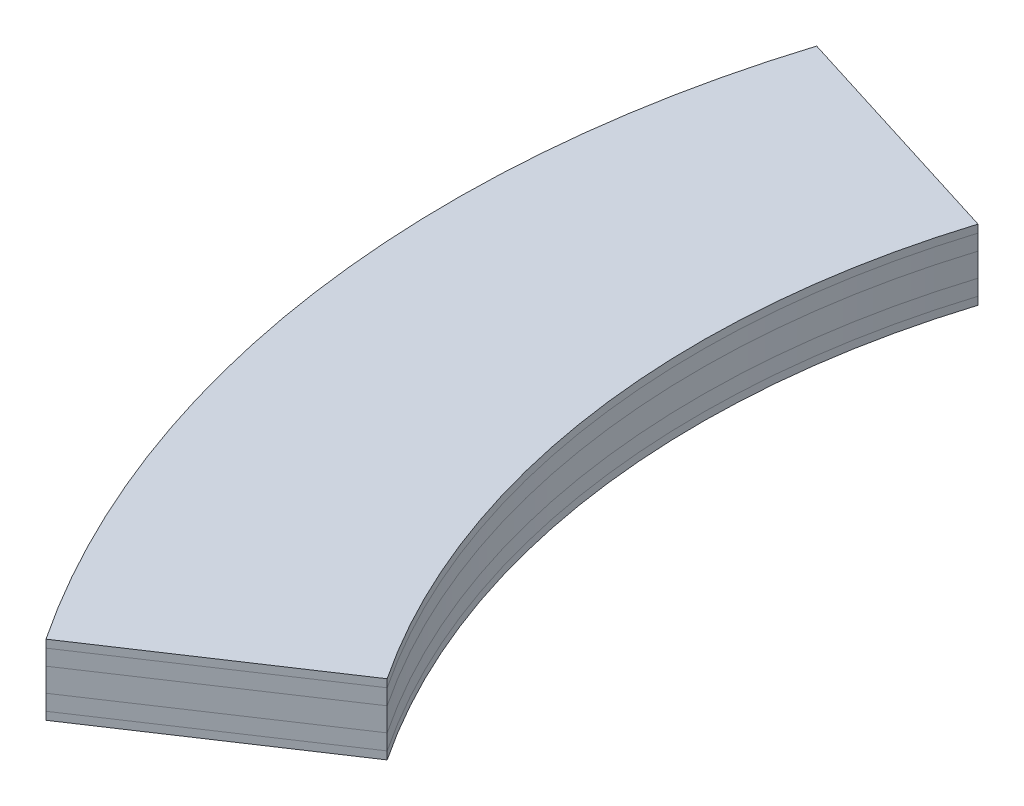
from build123d import *

# Parameters (mm, degrees)
SKETCH3_W                = 609.6
SKETCH3_H                = 1219.2
BOSS_EXTRUDE1_DEPTH      = 25.4
SPLIT1_SURFACE_1_1_BACK  = 1364.344
SPLIT1_SURFACE_1_1_DEPTH = 2728.688
SPLIT1_SURFACE_1_2_BACK  = 1364.344
SPLIT1_SURFACE_1_2_DEPTH = 2728.688
SPLIT1_SURFACE_2_3_BACK  = 1364.344
SPLIT1_SURFACE_2_3_DEPTH = 2728.688
SPLIT1_SURFACE_2_4_BACK  = 1364.344
SPLIT1_SURFACE_2_4_DEPTH = 2728.688
SPLIT1_SURFACE_3_5_BACK  = 1364.344
SPLIT1_SURFACE_3_5_DEPTH = 2728.688
SPLIT1_SURFACE_3_6_BACK  = 1364.344
SPLIT1_SURFACE_3_6_DEPTH = 2728.688
SPLIT1_SURFACE_4_7_BACK  = 1364.344
SPLIT1_SURFACE_4_7_DEPTH = 2728.688
SPLIT1_SURFACE_4_8_BACK  = 1364.344
SPLIT1_SURFACE_4_8_DEPTH = 2728.688
SKETCH6_W                = 609.6
SKETCH6_H                = 1219.2
CUT_EXTRUDE1_DEPTH       = 25.4


with BuildPart() as part:
    # Sketch3 → Boss-Extrude1 (new body)
    with BuildSketch(Plane(origin=(0, 0, 0), x_dir=(1, 0, 0), z_dir=(0, 1, 0))):
        Rectangle(SKETCH3_W, SKETCH3_H)
    extrude(amount=-BOSS_EXTRUDE1_DEPTH)


with BuildPart() as body_2:
    # Split1: the piece behind the surface
    add(part.part)
    # Split1 surface 1: a surface, the sketch's curves swept straight by 2728.688 mm
    with BuildLine(Plane.XY.offset(-SPLIT1_SURFACE_1_1_BACK), mode=Mode.PRIVATE) as split1_surface_1_1_path:
        Line((-335.28, -22.577777778), (335.28, -22.577777778))
    split1_surface_1_1 = Shell.extrude(split1_surface_1_1_path.wire(), (0 * SPLIT1_SURFACE_1_1_DEPTH, 0 * SPLIT1_SURFACE_1_1_DEPTH, 1 * SPLIT1_SURFACE_1_1_DEPTH))
    split(bisect_by=split1_surface_1_1, keep=Keep.BOTTOM)


with BuildPart() as part_1:
    add(part.part)

    # Split1: split by a surface, the side it looks to stays
    # Split1 surface 1: a surface, the sketch's curves swept straight by 2728.688 mm
    with BuildLine(Plane.XY.offset(-SPLIT1_SURFACE_1_2_BACK), mode=Mode.PRIVATE) as split1_surface_1_2_path:
        Line((-335.28, -22.577777778), (335.28, -22.577777778))
    split1_surface_1_2 = Shell.extrude(split1_surface_1_2_path.wire(), (0 * SPLIT1_SURFACE_1_2_DEPTH, 0 * SPLIT1_SURFACE_1_2_DEPTH, 1 * SPLIT1_SURFACE_1_2_DEPTH))
    split(bisect_by=split1_surface_1_2, keep=Keep.TOP)


with BuildPart() as body_3:
    # Split1 2: the piece behind the surface
    add(part_1.part)
    # Split1 surface 2: a surface, the sketch's curves swept straight by 2728.688 mm
    with BuildLine(Plane.XY.offset(-SPLIT1_SURFACE_2_3_BACK), mode=Mode.PRIVATE) as split1_surface_2_3_path:
        Line((-335.28, -16.933333333), (335.28, -16.933333333))
    split1_surface_2_3 = Shell.extrude(split1_surface_2_3_path.wire(), (0 * SPLIT1_SURFACE_2_3_DEPTH, 0 * SPLIT1_SURFACE_2_3_DEPTH, 1 * SPLIT1_SURFACE_2_3_DEPTH))
    split(bisect_by=split1_surface_2_3, keep=Keep.BOTTOM)


with BuildPart() as part_2:
    add(part_1.part)

    # Split1 2: split by a surface, the side it looks to stays
    # Split1 surface 2: a surface, the sketch's curves swept straight by 2728.688 mm
    with BuildLine(Plane.XY.offset(-SPLIT1_SURFACE_2_4_BACK), mode=Mode.PRIVATE) as split1_surface_2_4_path:
        Line((-335.28, -16.933333333), (335.28, -16.933333333))
    split1_surface_2_4 = Shell.extrude(split1_surface_2_4_path.wire(), (0 * SPLIT1_SURFACE_2_4_DEPTH, 0 * SPLIT1_SURFACE_2_4_DEPTH, 1 * SPLIT1_SURFACE_2_4_DEPTH))
    split(bisect_by=split1_surface_2_4, keep=Keep.TOP)


with BuildPart() as body_4_2:
    # Split1 3: the piece behind the surface
    add(part_2.part)
    # Split1 surface 3: a surface, the sketch's curves swept straight by 2728.688 mm
    with BuildLine(Plane.XY.offset(-SPLIT1_SURFACE_3_5_BACK), mode=Mode.PRIVATE) as split1_surface_3_5_path:
        Line((-335.28, -2.822222222), (335.28, -2.822222222))
    split1_surface_3_5 = Shell.extrude(split1_surface_3_5_path.wire(), (0 * SPLIT1_SURFACE_3_5_DEPTH, 0 * SPLIT1_SURFACE_3_5_DEPTH, 1 * SPLIT1_SURFACE_3_5_DEPTH))
    split(bisect_by=split1_surface_3_5, keep=Keep.BOTTOM)


with BuildPart() as part_3:
    add(part_2.part)

    # Split1 3: split by a surface, the side it looks to stays
    # Split1 surface 3: a surface, the sketch's curves swept straight by 2728.688 mm
    with BuildLine(Plane.XY.offset(-SPLIT1_SURFACE_3_6_BACK), mode=Mode.PRIVATE) as split1_surface_3_6_path:
        Line((-335.28, -2.822222222), (335.28, -2.822222222))
    split1_surface_3_6 = Shell.extrude(split1_surface_3_6_path.wire(), (0 * SPLIT1_SURFACE_3_6_DEPTH, 0 * SPLIT1_SURFACE_3_6_DEPTH, 1 * SPLIT1_SURFACE_3_6_DEPTH))
    split(bisect_by=split1_surface_3_6, keep=Keep.TOP)


with BuildPart() as body_5_2:
    # Split1 4 body 4 2: the piece behind the surface
    add(body_4_2.part)
    # Split1 surface 4: a surface, the sketch's curves swept straight by 2728.688 mm
    with BuildLine(Plane.XY.offset(-SPLIT1_SURFACE_4_7_BACK), mode=Mode.PRIVATE) as split1_surface_4_7_path:
        Line((-335.28, -8.466666667), (335.28, -8.466666667))
    split1_surface_4_7 = Shell.extrude(split1_surface_4_7_path.wire(), (0 * SPLIT1_SURFACE_4_7_DEPTH, 0 * SPLIT1_SURFACE_4_7_DEPTH, 1 * SPLIT1_SURFACE_4_7_DEPTH))
    split(bisect_by=split1_surface_4_7, keep=Keep.BOTTOM)


with BuildPart() as body_4_2_1:
    add(body_4_2.part)

    # Split1 4 body 4 2: split by a surface, the side it looks to stays
    # Split1 surface 4: a surface, the sketch's curves swept straight by 2728.688 mm
    with BuildLine(Plane.XY.offset(-SPLIT1_SURFACE_4_8_BACK), mode=Mode.PRIVATE) as split1_surface_4_8_path:
        Line((-335.28, -8.466666667), (335.28, -8.466666667))
    split1_surface_4_8 = Shell.extrude(split1_surface_4_8_path.wire(), (0 * SPLIT1_SURFACE_4_8_DEPTH, 0 * SPLIT1_SURFACE_4_8_DEPTH, 1 * SPLIT1_SURFACE_4_8_DEPTH))
    split(bisect_by=split1_surface_4_8, keep=Keep.TOP)


with BuildPart() as cut_extrude1_tool:
    # Sketch6 → Cut-Extrude1 (new body)
    with BuildSketch(Plane(origin=(0, 0, 0), x_dir=(1, 0, 0), z_dir=(0, 1, 0))):
        Rectangle(SKETCH6_W, SKETCH6_H)
        with BuildLine():
            Line((46.270357382, 282.443495849), (131.11209545, 255.889974774))
            ThreePointArc((131.11209545, 255.889974774), (120.707054174, 127.379073549), (166.640986072, 6.907539493))
            Line((166.640986072, 6.907539493), (92.612388628, -42.316202343))
            ThreePointArc((92.612388628, -42.316202343), (32.698564412, 114.820581208), (46.270357382, 282.443495849))
        make_face(mode=Mode.SUBTRACT)
    extrude(amount=-CUT_EXTRUDE1_DEPTH)


with BuildPart() as part_4:
    add(part_3.part)

    # Cut-Extrude1: cut by cut_extrude1_tool
    add(cut_extrude1_tool.part, mode=Mode.SUBTRACT)


with BuildPart() as body_2_1:
    add(body_2.part)

    # Cut-Extrude1: cut by cut_extrude1_tool
    add(cut_extrude1_tool.part, mode=Mode.SUBTRACT)


with BuildPart() as body_3_1:
    add(body_3.part)

    # Cut-Extrude1: cut by cut_extrude1_tool
    add(cut_extrude1_tool.part, mode=Mode.SUBTRACT)


with BuildPart() as body_4_2_2:
    add(body_4_2_1.part)

    # Cut-Extrude1: cut by cut_extrude1_tool
    add(cut_extrude1_tool.part, mode=Mode.SUBTRACT)


with BuildPart() as body_5_2_1:
    add(body_5_2.part)

    # Cut-Extrude1: cut by cut_extrude1_tool
    add(cut_extrude1_tool.part, mode=Mode.SUBTRACT)


solid = Compound([part_4.part, body_2_1.part, body_3_1.part, body_4_2_2.part, body_5_2_1.part])
